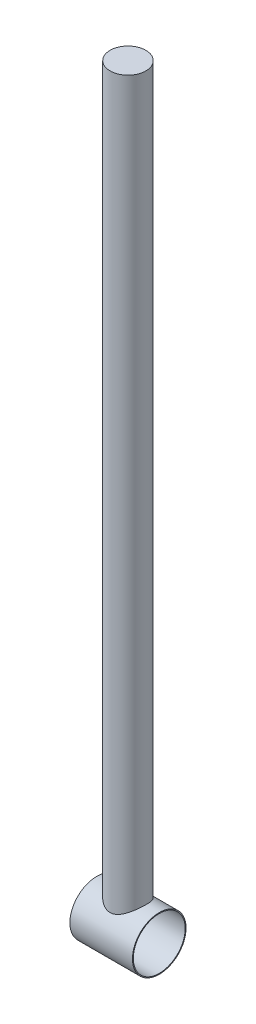
from build123d import *

# Parameters (mm, degrees)
SKETCH2_R                = 30
SKETCH2_R_2              = 29
BOSS_EXTRUDE3_DEPTH      = 35
BOSS_EXTRUDE4_REACH      = 895
BOSS_EXTRUDE4_END_RADIUS = 30
BOSS_EXTRUDE4_START      = 838
SKETCH1_R                = 20


with BuildPart() as part:
    # Sketch2 → Boss-Extrude3 (new, symmetric)
    with BuildSketch(Plane(origin=(0, 0, 0), x_dir=(0, 0, -1), z_dir=(1, 0, 0))):
        Circle(SKETCH2_R)
        Circle(SKETCH2_R_2, mode=Mode.SUBTRACT)
    extrude(amount=BOSS_EXTRUDE3_DEPTH, both=True)

    # Boss-Extrude4: up to this cylinder (the profile starts outside it)
    boss_extrude4_end = Plane(origin=(0, 0, 0), z_dir=(-1, 0, 0)) * Cylinder(BOSS_EXTRUDE4_END_RADIUS, 1851, mode=Mode.PRIVATE)
    # Sketch1 → Boss-Extrude4 (add, up to the surface)
    with BuildSketch(Plane(origin=(0, 0, 0), x_dir=(1, 0, 0), z_dir=(0, 1, 0)).offset(BOSS_EXTRUDE4_START), mode=Mode.PRIVATE) as boss_extrude4_sk1:
        with Locations(Location((0, 0, 0), (0, 0, 270))):
            Circle(SKETCH1_R)
    boss_extrude4_tool1 = extrude(boss_extrude4_sk1.sketch, amount=-BOSS_EXTRUDE4_REACH, mode=Mode.PRIVATE) - boss_extrude4_end
    add(boss_extrude4_tool1.solids().sort_by_distance((0, 838, 0))[0])


solid = part.part
